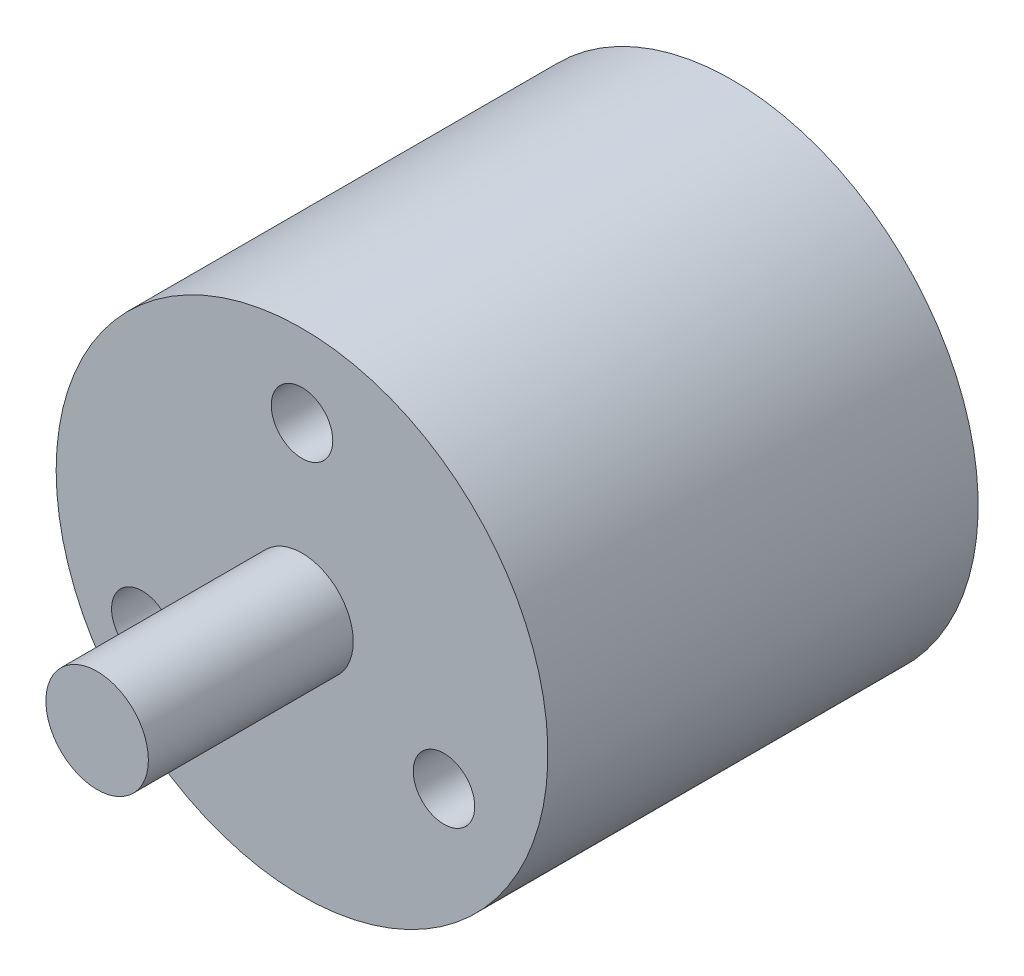
from build123d import *

# Parameters (mm, degrees)
ESQUISSE1_R             = 12
BOSS_EXTRU_1_DEPTH      = 21
ESQUISSE2_R             = 2.5
BOSS_EXTRU_2_DEPTH      = 10
ESQUISSE3_R             = 1.5
ESQUISSE3_R_2           = 1.501649619
ENL_V_MAT_EXTRU_1_DEPTH = 4


with BuildPart() as part:
    # Esquisse1 → Boss.-Extru.1 (new body)
    with BuildSketch(Plane.XY):
        with Locations(Location((0, 0, 0), (0, 0, 180))):
            Circle(ESQUISSE1_R)
    extrude(amount=BOSS_EXTRU_1_DEPTH)

    # Esquisse2 → Boss.-Extru.2 (add)
    with BuildSketch(Plane.XY.offset(21)):
        Circle(ESQUISSE2_R)
    extrude(amount=BOSS_EXTRU_2_DEPTH)

    # Esquisse3 → Enlèv. mat.-Extru.1 (cut)
    with BuildSketch(Plane.XY.offset(21)):
        with Locations((0, 8)):
            Circle(ESQUISSE3_R)
        with Locations((-7.794228634, -4.5)):
            Circle(ESQUISSE3_R_2)
        with Locations((6.92820323, -4)):
            Circle(ESQUISSE3_R)
    extrude(amount=-ENL_V_MAT_EXTRU_1_DEPTH, mode=Mode.SUBTRACT)


solid = part.part
